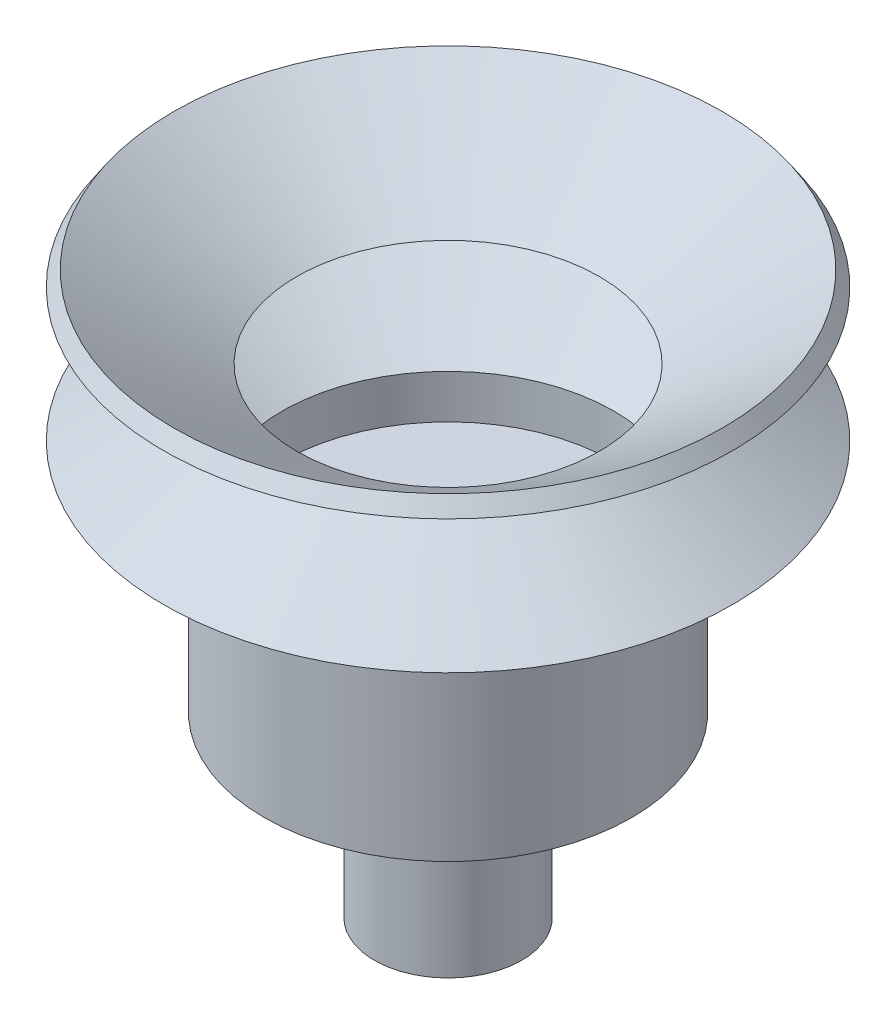
from build123d import *

# Parameters (mm, degrees)
ESQUISSE2_R        = 3.3
BOSS_EXTRU_1_DEPTH = 8


with BuildPart() as part:
    # Esquisse1 → Révolution1 (revolve)
    with BuildSketch(Plane.XY, mode=Mode.PRIVATE) as r_volution1_sk:
        Polygon((0, 0), (8.227125787, 0), (8.227125787, 7.51998689), (12.727125787, 10.504949201), (8.227125787, 13.489911513), (12.727125787, 16.474873824), (12.284909149, 17.141540491), (6.779871333, 13.489911513), (11.279871333, 10.504949201), (7.427125787, 7.949326924), (7.427125787, 5.989911513), (0, 5.989911513), align=None)
    revolve(r_volution1_sk.sketch.rotate(Axis((0, 0, 0), (0, 1, 0)), 90), axis=Axis((0, 0, 0), (0, 1, 0)))

    # Esquisse2 → Boss.-Extru.1 (add)
    with BuildSketch(Plane.XZ):
        with Locations(Location((0, 0, 0), (0, 0, 270))):
            Circle(ESQUISSE2_R)
    extrude(amount=BOSS_EXTRU_1_DEPTH)


solid = part.part
